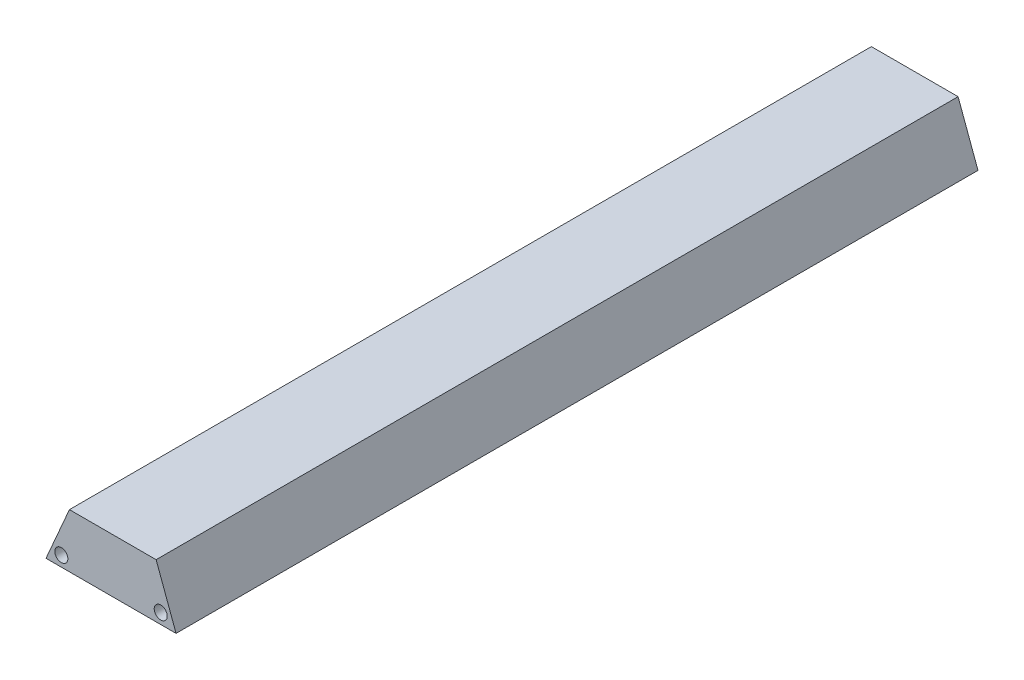
from build123d import *

# Parameters (mm, degrees)
BOSS_EXTRUDE1_DEPTH      = 18.5
BOSS_EXTRUDE1_DEPTH_BACK = 18.5
SKETCH1_R                = 0.3


with BuildPart() as part:
    # Sketch1 → Boss-Extrude1 (new, two sides: drawn at the far end of the back side and taken through both)
    with BuildSketch(Plane.XY.offset(-BOSS_EXTRUDE1_DEPTH_BACK)):
        Polygon((-1.955677856, 1.191654646), (2.044322144, 1.191654646), (2.963241063, -1.294831841), (-3.036758937, -1.294831841), align=None)
        with Locations((2.256164177, -0.813020011)):
            Circle(SKETCH1_R, mode=Mode.SUBTRACT)
        with Locations((-2.329682051, -0.813020011)):
            Circle(SKETCH1_R, mode=Mode.SUBTRACT)
    extrude(amount=BOSS_EXTRUDE1_DEPTH + BOSS_EXTRUDE1_DEPTH_BACK)


solid = part.part
